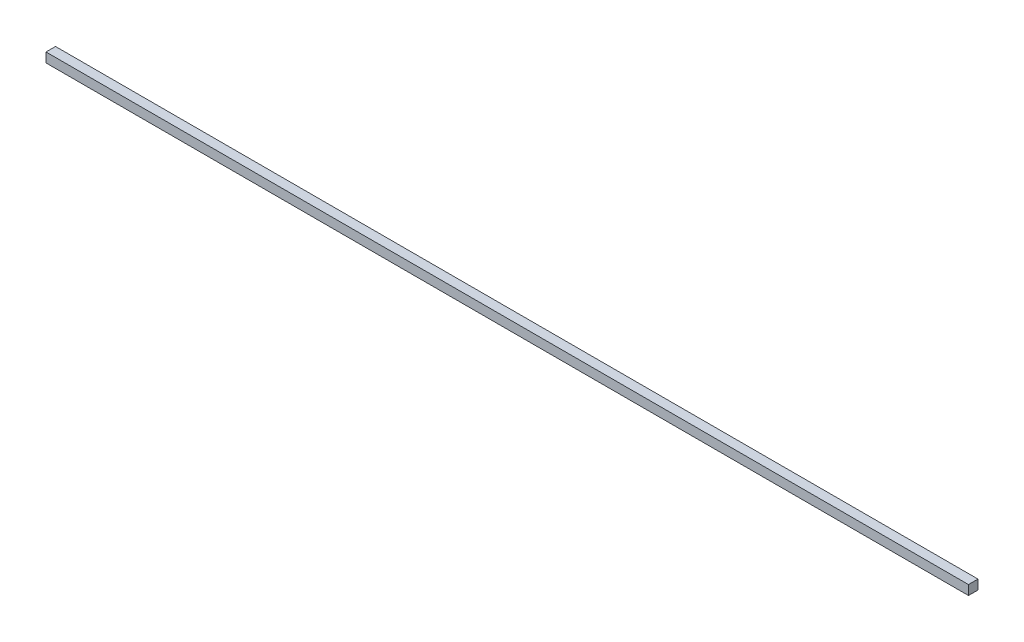
from build123d import *

# Parameters (mm, degrees)
SKETCH1_W           = 307.975
SKETCH1_H           = 3.175
BOSS_EXTRUDE1_DEPTH = 19.05
CUT_EXTRUDE6_REACH  = 310.58
SKETCH8_W           = 307.975
SKETCH8_H           = 15.875


with BuildPart() as part:
    # Sketch1 → Boss-Extrude1 (new body)
    with BuildSketch(Plane.XY):
        with Locations((153.9875, 1.5875)):
            Rectangle(SKETCH1_W, SKETCH1_H)
    extrude(amount=BOSS_EXTRUDE1_DEPTH)

    # Sketch8 → Cut-Extrude6 (cut, up to next)
    with BuildSketch(Plane(origin=(0, 3.175, 0), x_dir=(1, 0, 0), z_dir=(0, 1, 0)), mode=Mode.PRIVATE) as cut_extrude6_sk1:
        with Locations((153.9875, -7.9375)):
            Rectangle(SKETCH8_W, SKETCH8_H)
    cut_extrude6_tool1 = extrude(cut_extrude6_sk1.sketch, amount=-CUT_EXTRUDE6_REACH, mode=Mode.PRIVATE) & part.part
    add(cut_extrude6_tool1.solids().sort_by_distance((153.9875, 3.175, 7.9375))[0], mode=Mode.SUBTRACT)


solid = part.part
